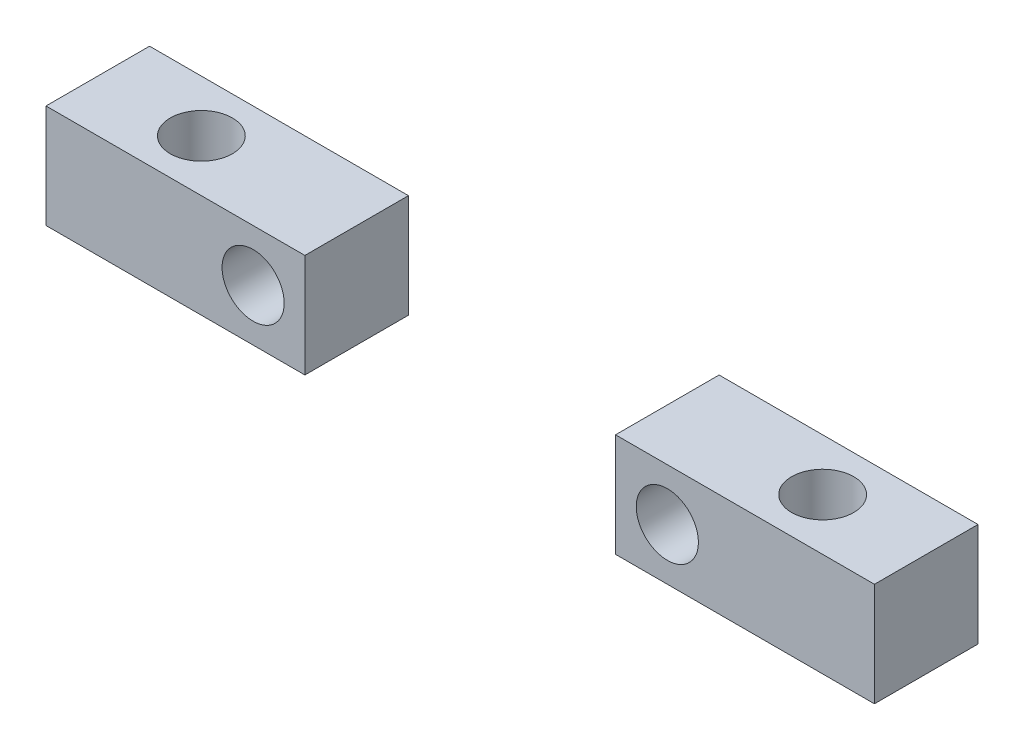
from build123d import *

# Parameters (mm, degrees)
ESQUISSE1_W      = 80
ESQUISSE1_H      = 10
EXTRUSION1_DEPTH = 10
ESQUISSE2_R      = 3
EXTRUSION2_DEPTH = 43.426406871
ESQUISSE3_R      = 3
EXTRUSION3_DEPTH = 43.426406871
ESQUISSE4_W      = 30
ESQUISSE4_H      = 26.006337845
EXTRUSION4_DEPTH = 43.426406871


with BuildPart() as part:
    # Esquisse1 → Extrusion1 (new body)
    with BuildSketch(Plane(origin=(0, 0, 0), x_dir=(1, 0, 0), z_dir=(0, 1, 0))):
        with Locations((0, 5)):
            Rectangle(ESQUISSE1_W, ESQUISSE1_H)
    extrude(amount=EXTRUSION1_DEPTH)

    # Esquisse2 → Extrusion2 (cut, through all)
    with BuildSketch(Plane.XY):
        with Locations((20, 5)):
            Circle(ESQUISSE2_R)
        with Locations((-20, 5)):
            Circle(ESQUISSE2_R)
    extrude(amount=-EXTRUSION2_DEPTH, mode=Mode.SUBTRACT)

    # Esquisse3 → Extrusion3 (cut, through all)
    with BuildSketch(Plane(origin=(0, 10, 0), x_dir=(1, 0, 0), z_dir=(0, 1, 0))):
        with Locations(Location((30, 5, 0), (0, 0, 270))):
            Circle(ESQUISSE3_R)
        with Locations(Location((-30, 5, 0), (0, 0, 270))):
            Circle(ESQUISSE3_R)
    extrude(amount=-EXTRUSION3_DEPTH, mode=Mode.SUBTRACT)

    # Esquisse4 → Extrusion4 (cut, through all)
    with BuildSketch(Plane.XY):
        with Locations((0, 3.418533509)):
            Rectangle(ESQUISSE4_W, ESQUISSE4_H)
    extrude(amount=-EXTRUSION4_DEPTH, mode=Mode.SUBTRACT)


with BuildPart() as extrusion4_piece_1:
    # of the separate pieces the step leaves, piece 1, a body of its own (extrusion4_pieces)
    add(part.part.solids().sort_by_distance((15, 0, -10))[0])


with BuildPart() as extrusion4_piece_2:
    # of the separate pieces the step leaves, piece 2, a body of its own (extrusion4_pieces)
    add(part.part.solids().sort_by_distance((-40, 0, -10))[0])


solid = Compound([extrusion4_piece_1.part, extrusion4_piece_2.part])
